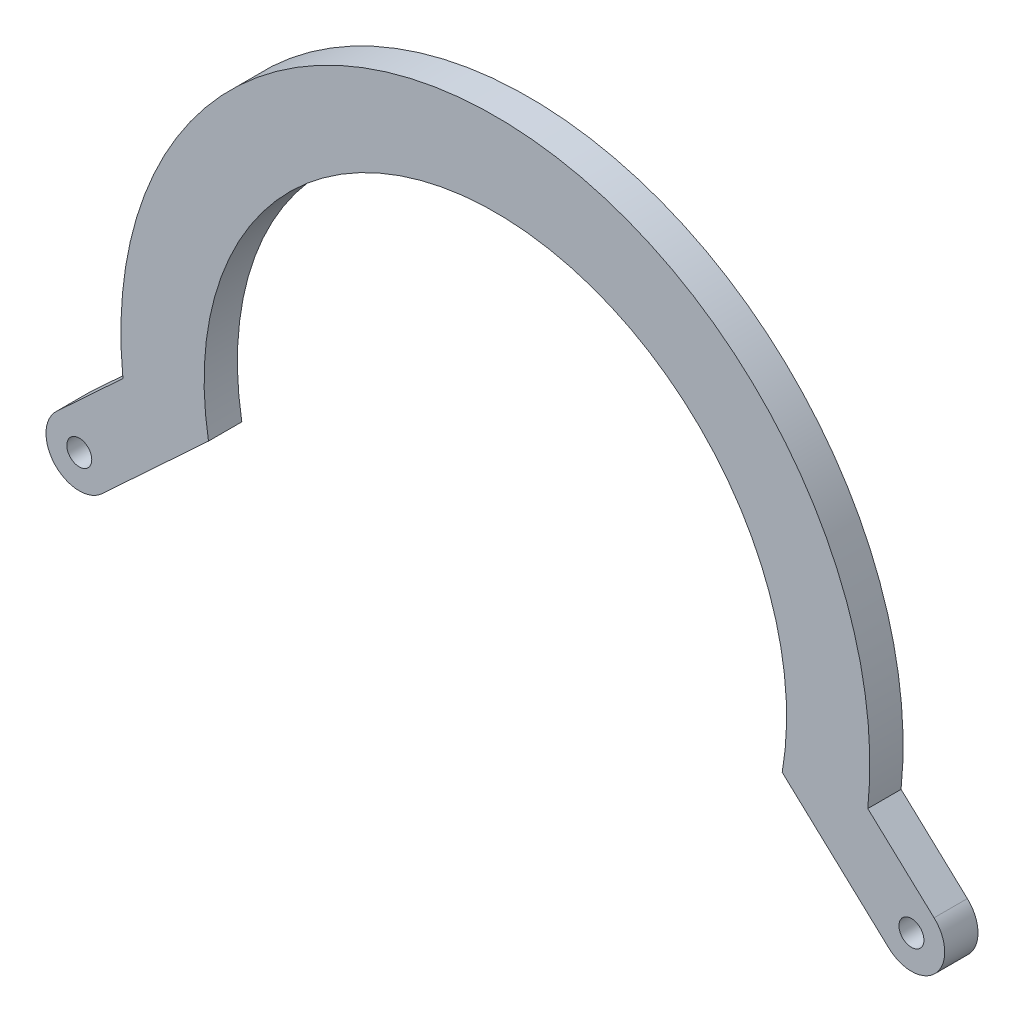
from build123d import *

# Parameters (mm, degrees)
SKETCH_1_R      = 1.5
EXTRUDE_1_DEPTH = 4


with BuildPart() as part:
    # 草图1 → 凸台-拉伸1 (new body)
    with BuildSketch(Plane.XY):
        with BuildLine():
            Line((-52.719813515, -12.066978615), (-44.755782691, -4.681870965))
            ThreePointArc((-44.755782691, -4.681870965), (0, 45), (44.755782691, -4.681870965))
            Line((44.755782691, -4.681870965), (52.719813515, -12.066978615))
            ThreePointArc((52.719813515, -12.066978615), (52.933021385, -17.719813515), (47.280186485, -17.933021385))
            Line((47.280186485, -17.933021385), (34.472092367, -6.055976211))
            ThreePointArc((34.472092367, -6.055976211), (0, 35), (-34.472092367, -6.055976211))
            Line((-34.472092367, -6.055976211), (-47.280186485, -17.933021385))
            ThreePointArc((-47.280186485, -17.933021385), (-52.933021385, -17.719813515), (-52.719813515, -12.066978615))
        make_face()
        with Locations((-50, -15)):
            Circle(SKETCH_1_R, mode=Mode.SUBTRACT)
        with Locations((50, -15)):
            Circle(SKETCH_1_R, mode=Mode.SUBTRACT)
    extrude(amount=EXTRUDE_1_DEPTH)


solid = part.part
